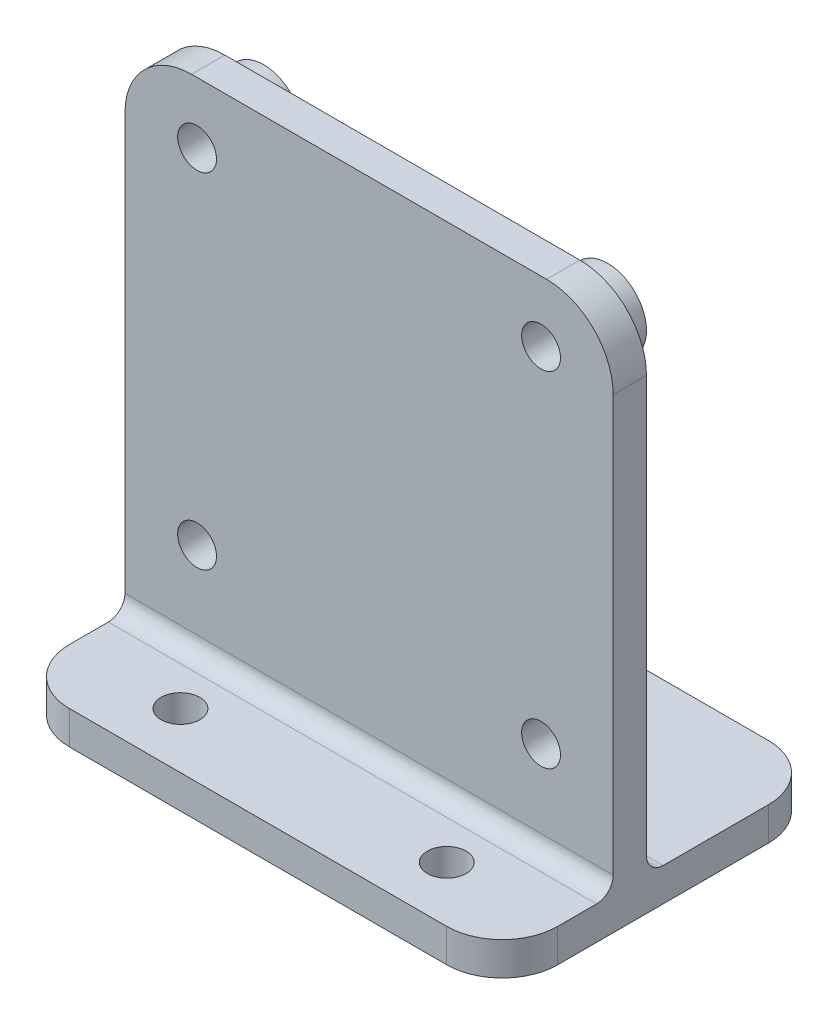
from build123d import *

# Parameters (mm, degrees)
SALIENTE_EXTRUIR1_DEPTH = 22
CROQUIS4_R              = 1.75
CORTAR_EXTRUIR1_DEPTH   = 56.172456897
CROQUIS5_R              = 1.75
CORTAR_EXTRUIR2_DEPTH   = 54.058929503
REDONDEO1_R             = 6
REDONDEO2_R             = 5
REDONDEO3_R             = 1.5
SALIENTE_EXTRUIR2_START = 3
CROQUIS6_R              = 3.5
CROQUIS6_R_2            = 1.75
SALIENTE_EXTRUIR2_DEPTH = 3


with BuildPart() as part:
    # Croquis3 → Saliente-Extruir1 (new, symmetric)
    with BuildSketch(Plane(origin=(0, 0, 0), x_dir=(0, 0, -1), z_dir=(1, 0, 0))):
        Polygon((-11.5, 0), (-11.5, 3), (-1.5, 3), (-1.5, 48), (1.5, 48), (1.5, 3), (17.5, 3), (17.5, 0), (0, 0), align=None)
    extrude(amount=SALIENTE_EXTRUIR1_DEPTH, both=True)

    # Croquis4 → Cortar-Extruir1 (cut, through all)
    with BuildSketch(Plane(origin=(0, 0, -1.5), x_dir=(-1, 0, 0), z_dir=(0, 0, -1))):
        with Locations(Location((15.5, 42.5, 0), (0, 0, 90))):
            Circle(CROQUIS4_R)
        with Locations(Location((-15.5, 11.5, 0), (0, 0, 90))):
            Circle(CROQUIS4_R)
    cortar_extruir1 = extrude(amount=-CORTAR_EXTRUIR1_DEPTH, mode=Mode.SUBTRACT)

    # Simetría1: Cortar-Extruir1 across plane
    add(cortar_extruir1.mirror(Plane(origin=(0, 0, 0), x_dir=(0, 0, 1), z_dir=(1, 0, 0))), mode=Mode.SUBTRACT)

    # Croquis5 → Cortar-Extruir2 (cut, through all)
    with BuildSketch(Plane(origin=(0, 3, 0), x_dir=(1, 0, 0), z_dir=(0, 1, 0))):
        with Locations(Location((-12, -6.5, 0), (0, 0, 270))):
            Circle(CROQUIS5_R)
        with Locations(Location((12, -6.5, 0), (0, 0, 270))):
            Circle(CROQUIS5_R)
    extrude(amount=-CORTAR_EXTRUIR2_DEPTH, mode=Mode.SUBTRACT)

    # Redondeo1
    redondeo1_edges = [part.edges().sort_by_distance(p)[0] for p in [
        (-22, 48, 0),
        (22, 48, 0),
    ]]
    fillet(redondeo1_edges, radius=REDONDEO1_R)

    # Redondeo2
    redondeo2_edges = [part.edges().sort_by_distance(p)[0] for p in [
        (-22, 1.5, 11.5),
        (-22, 1.5, -17.5),
        (22, 1.5, 11.5),
        (22, 1.5, -17.5),
    ]]
    fillet(redondeo2_edges, radius=REDONDEO2_R)

    # Redondeo3
    redondeo3_edges = [part.edges().sort_by_distance(p)[0] for p in [
        (0, 3, 1.5),
        (0, 3, -1.5),
    ]]
    fillet(redondeo3_edges, radius=REDONDEO3_R)

    # Croquis6 → Saliente-Extruir2 (add)
    # profile 1 of 2: a face of its own
    with BuildSketch(Plane(origin=(0, 0, -1.5), x_dir=(-1, 0, 0), z_dir=(0, 0, -1)).offset(SALIENTE_EXTRUIR2_START)):
        with Locations(Location((-15.5, 42.5, 0), (0, 0, 270))):
            Circle(CROQUIS6_R)
        with Locations(Location((-15.5, 42.5, 0), (0, 0, 90))):
            Circle(CROQUIS6_R_2, mode=Mode.SUBTRACT)
    # profile 2 of 2: a face of its own
    with BuildSketch(Plane(origin=(0, 0, -1.5), x_dir=(-1, 0, 0), z_dir=(0, 0, -1)).offset(SALIENTE_EXTRUIR2_START)):
        with Locations(Location((-15.5, 11.5, 0), (0, 0, 270))):
            Circle(CROQUIS6_R)
        with Locations(Location((-15.5, 11.5, 0), (0, 0, 90))):
            Circle(CROQUIS6_R_2, mode=Mode.SUBTRACT)
    saliente_extruir2 = extrude(amount=-SALIENTE_EXTRUIR2_DEPTH)

    # Simetría2: Saliente-Extruir2 across plane
    add(saliente_extruir2.mirror(Plane(origin=(0, 0, 0), x_dir=(0, 0, 1), z_dir=(1, 0, 0))))


solid = part.part
